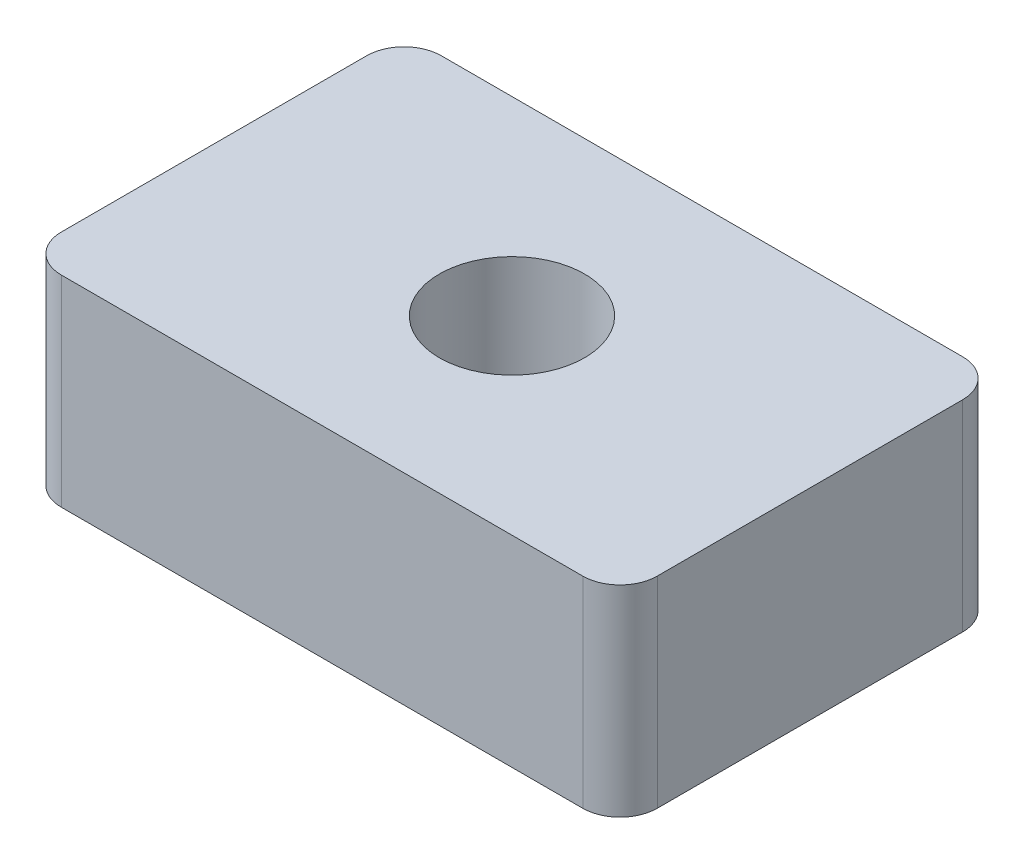
from build123d import *

# Parameters (mm, degrees)
CROQUIS1_W              = 80
CROQUIS1_H              = 51
SALIENTE_EXTRUIR1_DEPTH = 27
CROQUIS2_R              = 9.75
CORTAR_EXTRUIR1_DEPTH   = 27
REDONDEO1_R             = 5


with BuildPart() as part:
    # Croquis1 → Saliente-Extruir1 (new body)
    with BuildSketch(Plane(origin=(0, 0, 0), x_dir=(1, 0, 0), z_dir=(0, 1, 0))):
        with Locations((40, 25.5)):
            Rectangle(CROQUIS1_W, CROQUIS1_H)
    extrude(amount=SALIENTE_EXTRUIR1_DEPTH)

    # Croquis2 → Cortar-Extruir1 (cut)
    with BuildSketch(Plane(origin=(0, 27, 0), x_dir=(1, 0, 0), z_dir=(0, 1, 0))):
        with Locations(Location((40, 25.5, 0), (0, 0, 270))):
            Circle(CROQUIS2_R)
    extrude(amount=-CORTAR_EXTRUIR1_DEPTH, mode=Mode.SUBTRACT)

    # Redondeo1
    redondeo1_edges = [part.edges().sort_by_distance(p)[0] for p in [
        (0, 13.5, -51),
        (80, 13.5, -51),
        (80, 13.5, 0),
        (0, 13.5, 0),
    ]]
    fillet(redondeo1_edges, radius=REDONDEO1_R)


solid = part.part
